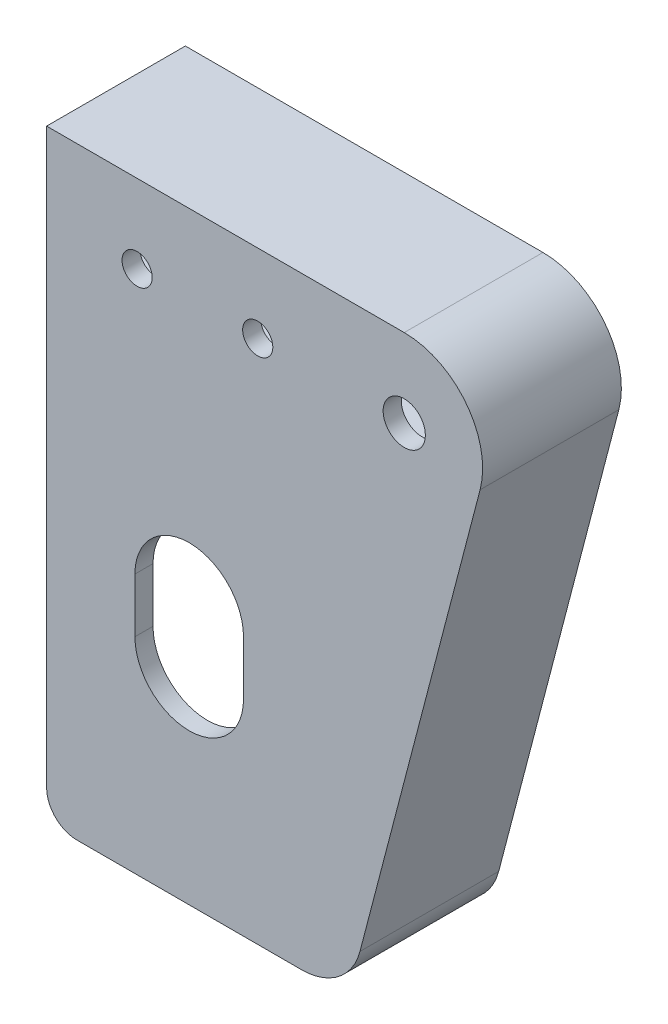
from build123d import *

# Parameters (mm, degrees)
BOSS_EXTRUDE1_DEPTH = 3
BOSS_EXTRUDE2_DEPTH = 20
SKETCH3_R           = 3.5
CUT_EXTRUDE1_DEPTH  = 20
BOSS_EXTRUDE3_DEPTH = 3
FILLET1_R           = 10
FILLET3_R           = 5
BOSS_EXTRUDE4_DEPTH = 20
CUT_EXTRUDE2_DEPTH  = 20
CUT_EXTRUDE4_DEPTH  = 20


with BuildPart() as part:
    # Sketch1 → Boss-Extrude1 (new body)
    with BuildSketch(Plane.XY):
        with BuildLine():
            Line((-35, 10), (24.289684969, 10))
            ThreePointArc((24.289684969, 10), (37.289684969, -3), (24.289684969, -16))
            Line((24.289684969, -16), (-35, -16))
            Line((-35, -16), (-35, 10))
        make_face()
    extrude(amount=-BOSS_EXTRUDE1_DEPTH)

    # Sketch2 → Boss-Extrude2 (add)
    with BuildSketch(Plane(origin=(0, 0, -3), x_dir=(-1, 0, 0), z_dir=(0, 0, -1))):
        with BuildLine():
            Line((-24.289684969, 7), (35, 7))
            Line((35, 7), (35, 10))
            Line((35, 10), (-24.289684969, 10))
            ThreePointArc((-24.289684969, 10), (-37.289684969, -3), (-24.289684969, -16))
            Line((-24.289684969, -16), (35, -16))
            Line((35, -16), (35, -13))
            Line((35, -13), (-24.289684969, -13))
            ThreePointArc((-24.289684969, -13), (-34.289684969, -3), (-24.289684969, 7))
        make_face()
    extrude(amount=BOSS_EXTRUDE2_DEPTH)

    # Sketch3 → Cut-Extrude1 (cut)
    with BuildSketch(Plane.XY):
        with Locations((24.289684969, -3)):
            Circle(SKETCH3_R)
    extrude(amount=-CUT_EXTRUDE1_DEPTH, mode=Mode.SUBTRACT)

    # Sketch4 → Boss-Extrude3 (add)
    with BuildSketch(Plane.XY):
        with BuildLine():
            Line((24.289684969, -16), (-35, -16))
            Line((-35, -16), (-35, -90))
            Line((-35, -90), (15, -90))
            Line((15, -90), (36.86764108, -6.285577584))
            ThreePointArc((36.86764108, -6.285577584), (32.235988871, -13.288646864), (24.289684969, -16))
        make_face()
    extrude(amount=-BOSS_EXTRUDE3_DEPTH)

    # Fillet1
    fillet1_edges = [part.edges().sort_by_distance(p)[0] for p in [
        (15, -90, -1.5),
    ]]
    fillet(fillet1_edges, radius=FILLET1_R)

    # Fillet3
    fillet3_edges = [part.edges().sort_by_distance(p)[0] for p in [
        (-35, -90, -1.5),
    ]]
    fillet(fillet3_edges, radius=FILLET3_R)

    # Sketch5 → Boss-Extrude4 (add)
    with BuildSketch(Plane(origin=(0, 0, -3), x_dir=(-1, 0, 0), z_dir=(0, 0, -1))):
        with BuildLine():
            Line((-14.049374385, -81.769157161), (-31.865646811, -13.564317402))
            ThreePointArc((-31.865646811, -13.564317402), (-35.003699882, -10.362736207), (-36.86764108, -6.285577584))
            Line((-36.86764108, -6.285577584), (-16.951979641, -82.527367373))
            ThreePointArc((-16.951979641, -82.527367373), (-13.389170249, -87.914343742), (-7.276628786, -90))
            Line((-7.276628786, -90), (30, -90))
            Line((30, -90), (30, -87))
            Line((30, -87), (-7.276628786, -87))
            ThreePointArc((-7.276628786, -87), (-11.55540781, -85.540040619), (-14.049374385, -81.769157161))
        make_face()
    extrude(amount=BOSS_EXTRUDE4_DEPTH)

    # Sketch7 → Cut-Extrude2 (cut)
    with BuildSketch(Plane(origin=(0, 0, -3), x_dir=(-1, 0, 0), z_dir=(0, 0, -1))):
        with BuildLine():
            ThreePointArc((-2.5, -3), (0, -5.5), (2.5, -3))
            Line((2.5, -3), (-2.5, -3))
        make_face()
        with BuildLine():
            Line((-2.5, -3), (2.5, -3))
            ThreePointArc((2.5, -3), (0, -0.5), (-2.5, -3))
        make_face()
        with BuildLine():
            ThreePointArc((17.5, -3), (20, -5.5), (22.5, -3))
            Line((22.5, -3), (17.5, -3))
        make_face()
        with BuildLine():
            Line((17.5, -3), (22.5, -3))
            ThreePointArc((22.5, -3), (20, -0.5), (17.5, -3))
        make_face()
    extrude(amount=-CUT_EXTRUDE2_DEPTH, mode=Mode.SUBTRACT)

    # Sketch6 → Cut-Extrude4 (cut)
    with BuildSketch(Plane(origin=(0, 0, -3), x_dir=(-1, 0, 0), z_dir=(0, 0, -1))):
        with BuildLine():
            Line((20.361685607, -56), (20.361685607, -47))
            ThreePointArc((20.361685607, -47), (11.361685607, -38), (2.361685607, -47))
            Line((2.361685607, -47), (2.361685607, -56))
            ThreePointArc((2.361685607, -56), (11.361685607, -65), (20.361685607, -56))
        make_face()
    extrude(amount=-CUT_EXTRUDE4_DEPTH, mode=Mode.SUBTRACT)


solid = part.part
